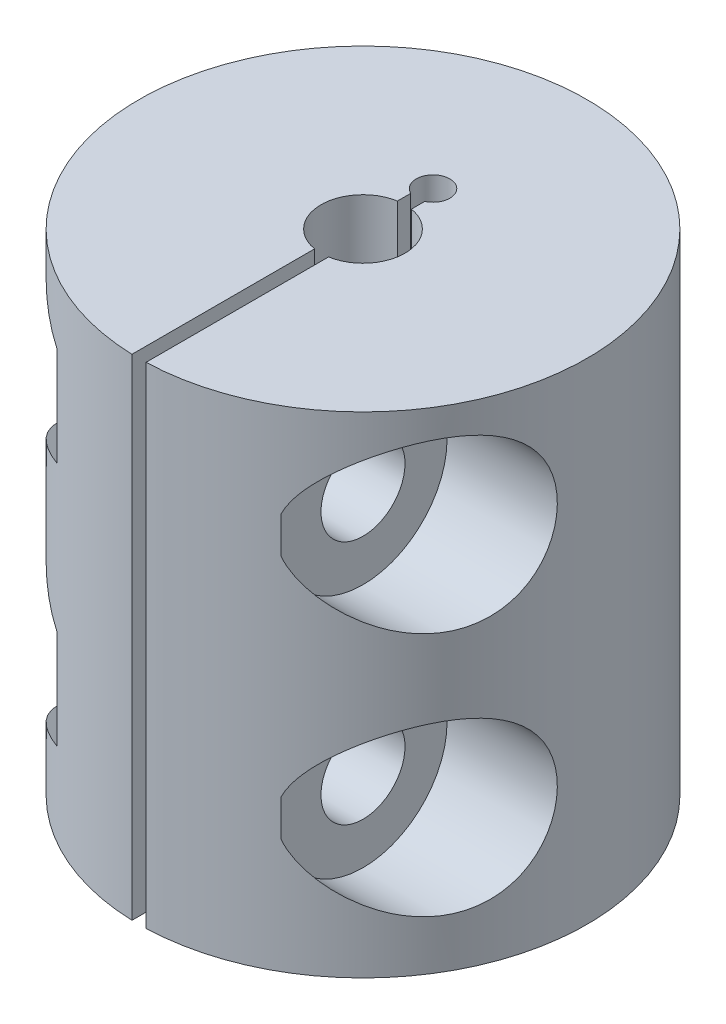
from build123d import *

# Parameters (mm, degrees)
SALIENTE_EXTRUIR1_DEPTH    = 8
SALIENTE_EXTRUIR2_START    = -9.5
SALIENTE_EXTRUIR2_DEPTH    = 9.5
CORTAR_EXTRUIR1_DEPTH      = 15.773286703
CORTAR_EXTRUIR1_DEPTH_BACK = 15.773286703
CROQUIS3_R                 = 1.5
CROQUIS5_R                 = 3
CORTAR_EXTRUIR2_DEPTH      = 4
CORTAR_EXTRUIR4_DEPTH      = 4
CORTAR_EXTRUIR3_DEPTH      = 15.773286703
CORTAR_EXTRUIR3_DEPTH_BACK = 15.773286703
CROQUIS6_OUTSIDE_W         = 23.722
CROQUIS6_OUTSIDE_H         = 23.722
CROQUIS6_OUTSIDE_R         = 8


with BuildPart() as part:
    # Croquis1 → Saliente-Extruir1 (new body)
    with BuildSketch(Plane(origin=(0, 0, 0), x_dir=(1, 0, 0), z_dir=(0, 1, 0))):
        with BuildLine():
            Line((-0.25, -7.996092796), (-0.25, -1.479019946))
            ThreePointArc((-0.25, -1.479019946), (-1.5, 0), (-0.25, 1.479019946))
            Line((-0.25, 1.479019946), (-0.25, 1.954564394))
            ThreePointArc((-0.25, 1.954564394), (0, 3.1), (0.25, 1.954564394))
            Line((0.25, 1.954564394), (0.25, 1.479019946))
            ThreePointArc((0.25, 1.479019946), (1.5, 0), (0.25, -1.479019946))
            Line((0.25, -1.479019946), (0.25, -7.996092796))
            Line((0.25, -7.996092796), (0.25, -8))
            Line((0.25, -8), (8, -8))
            Line((8, -8), (8, 8))
            Line((8, 8), (-8, 8))
            Line((-8, 8), (-8, -8))
            Line((-8, -8), (-0.25, -8))
            Line((-0.25, -8), (-0.25, -7.996092796))
        make_face()
    extrude(amount=SALIENTE_EXTRUIR1_DEPTH)

    # Croquis2 → Saliente-Extruir2 (add)
    with BuildSketch(Plane(origin=(0, 0, 0), x_dir=(1, 0, 0), z_dir=(0, 1, 0)).offset(SALIENTE_EXTRUIR2_START)):
        with BuildLine():
            Line((0.25, -1.479019946), (0.25, -8))
            Line((0.25, -8), (8, -8))
            Line((8, -8), (8, 8))
            Line((8, 8), (-8, 8))
            Line((-8, 8), (-8, -8))
            Line((-8, -8), (-0.25, -8))
            Line((-0.25, -8), (-0.25, -1.479019946))
            Line((-0.25, -1.479019946), (-0.25, -0.968245837))
            ThreePointArc((-0.25, -0.968245837), (-1, 0), (-0.25, 0.968245837))
            Line((-0.25, 0.968245837), (-0.25, 1.479019946))
            Line((-0.25, 1.479019946), (-0.25, 1.954564394))
            ThreePointArc((-0.25, 1.954564394), (0, 3.1), (0.25, 1.954564394))
            Line((0.25, 1.954564394), (0.25, 1.479019946))
            Line((0.25, 1.479019946), (0.25, 0.968245837))
            ThreePointArc((0.25, 0.968245837), (1, 0), (0.25, -0.968245837))
            Line((0.25, -0.968245837), (0.25, -1.479019946))
        make_face()
    extrude(amount=SALIENTE_EXTRUIR2_DEPTH)

    # Croquis3 → Cortar-Extruir1 (cut, two sides: drawn at the far end of the back side and taken through both)
    with BuildSketch(Plane(origin=(0, 0, 0), x_dir=(0, 0, -1), z_dir=(1, 0, 0)).offset(-CORTAR_EXTRUIR1_DEPTH_BACK)):
        with Locations((-4, 4)):
            Circle(CROQUIS3_R)
        with Locations((-4, -4.75)):
            Circle(CROQUIS3_R)
    extrude(amount=CORTAR_EXTRUIR1_DEPTH + CORTAR_EXTRUIR1_DEPTH_BACK, mode=Mode.SUBTRACT)

    # Croquis5 → Cortar-Extruir2 (cut)
    with BuildSketch(Plane(origin=(8, 0, 0), x_dir=(0, 0, -1), z_dir=(1, 0, 0))):
        with Locations((-4, 4)):
            Circle(CROQUIS5_R)
        with Locations((-4, -4.75)):
            Circle(CROQUIS5_R)
    extrude(amount=-CORTAR_EXTRUIR2_DEPTH, mode=Mode.SUBTRACT)

    # Croquis7 → Cortar-Extruir4 (cut)
    with BuildSketch(Plane.ZY.offset(8)):
        Polygon((1, 5.732050808), (1, 2.267949192), (4, 0.535898385), (7, 2.267949192), (7, 5.732050808), (4, 7.464101615), align=None)
        Polygon((1, -3.017949192), (1, -6.482050808), (4, -8.214101615), (7, -6.482050808), (7, -3.017949192), (4, -1.285898385), align=None)
    extrude(amount=-CORTAR_EXTRUIR4_DEPTH, mode=Mode.SUBTRACT)

    # Croquis6 outside → Cortar-Extruir3 (cut, two sides: drawn at the far end of the back side and taken through both)
    with BuildSketch(Plane(origin=(0, 0, 0), x_dir=(1, 0, 0), z_dir=(0, 1, 0)).offset(-CORTAR_EXTRUIR3_DEPTH_BACK)):
        Rectangle(CROQUIS6_OUTSIDE_W, CROQUIS6_OUTSIDE_H)
        Circle(CROQUIS6_OUTSIDE_R, mode=Mode.SUBTRACT)
    extrude(amount=CORTAR_EXTRUIR3_DEPTH + CORTAR_EXTRUIR3_DEPTH_BACK, mode=Mode.SUBTRACT)


solid = part.part
